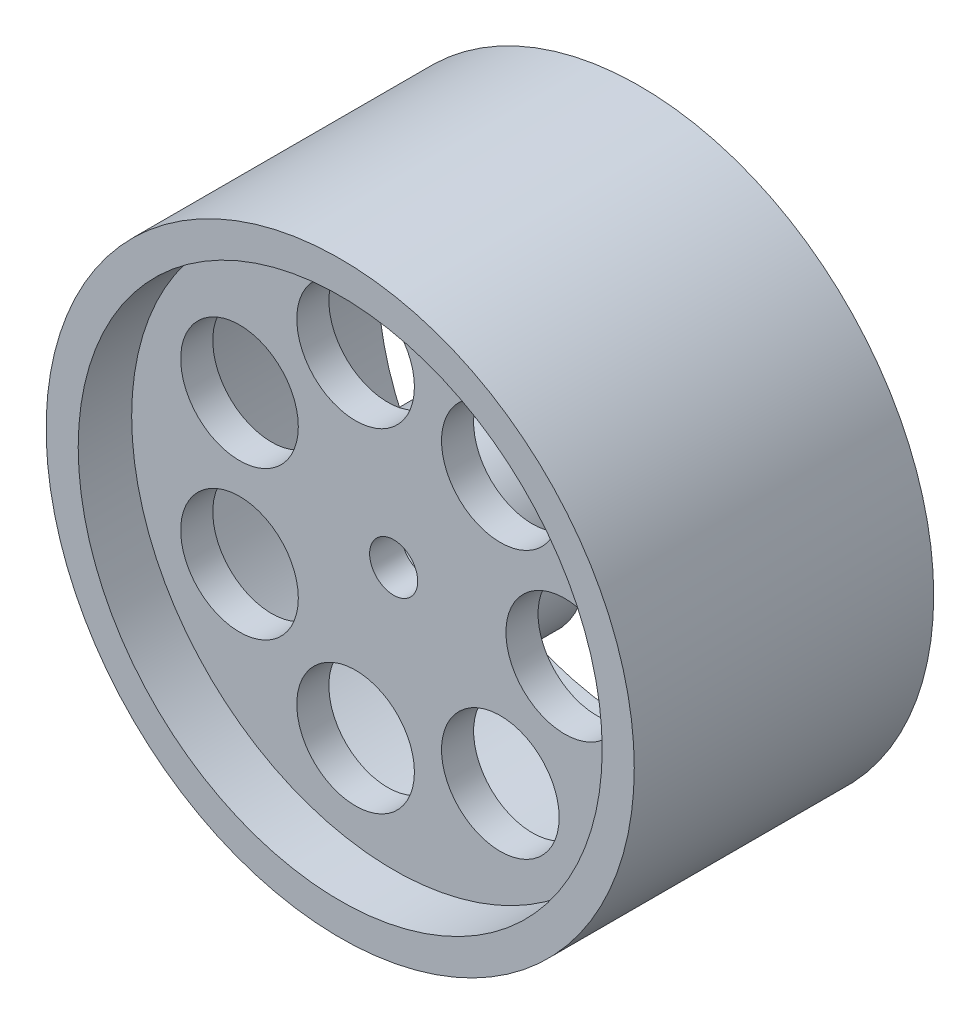
from build123d import *

# Parameters (mm, degrees)
RIM_BARREL_START  = -14
PROFILE_1_R       = 27.5
PROFILE_1_R_2     = 24.5
RIM_BARREL_DEPTH  = 28
SPOKE_WEB_START   = 6
PROFILE_2_R       = 25
PROFILE_2_R_2     = 2.25
PROFILE_2_R_3     = 5.5
SPOKE_WEB_DEPTH   = 3
PROFILE_3_R       = 9
AF12_SOCKET_DEPTH = 6


with BuildPart() as part:
    # Profile_1 → Rim_barrel (new body)
    with BuildSketch(Plane.XY.offset(RIM_BARREL_START)):
        Circle(PROFILE_1_R)
        Circle(PROFILE_1_R_2, mode=Mode.SUBTRACT)
    extrude(amount=RIM_BARREL_DEPTH)

    # Profile_2 → Spoke_web (add)
    with BuildSketch(Plane.XY.offset(SPOKE_WEB_START)):
        Circle(PROFILE_2_R)
        Circle(PROFILE_2_R_2, mode=Mode.SUBTRACT)
        with Locations((16, 0)):
            Circle(PROFILE_2_R_3, mode=Mode.SUBTRACT)
        with Locations((9.97583683, 12.509303719)):
            Circle(PROFILE_2_R_3, mode=Mode.SUBTRACT)
        with Locations((-3.560334943, 15.598846595)):
            Circle(PROFILE_2_R_3, mode=Mode.SUBTRACT)
        with Locations((-14.415501886, 6.942139826)):
            Circle(PROFILE_2_R_3, mode=Mode.SUBTRACT)
        with Locations((-14.415501886, -6.942139826)):
            Circle(PROFILE_2_R_3, mode=Mode.SUBTRACT)
        with Locations((-3.560334943, -15.598846595)):
            Circle(PROFILE_2_R_3, mode=Mode.SUBTRACT)
        with Locations((9.97583683, -12.509303719)):
            Circle(PROFILE_2_R_3, mode=Mode.SUBTRACT)
    extrude(amount=SPOKE_WEB_DEPTH)

    # Profile_3 → AF12_socket (add)
    with BuildSketch(Plane.XY):
        Circle(PROFILE_3_R)
        Polygon((6.06, 3.498742631), (0, 6.997485263), (-6.06, 3.498742631), (-6.06, -3.498742631), (0, -6.997485263), (6.06, -3.498742631), align=None, mode=Mode.SUBTRACT)
    extrude(amount=AF12_SOCKET_DEPTH)


solid = part.part
